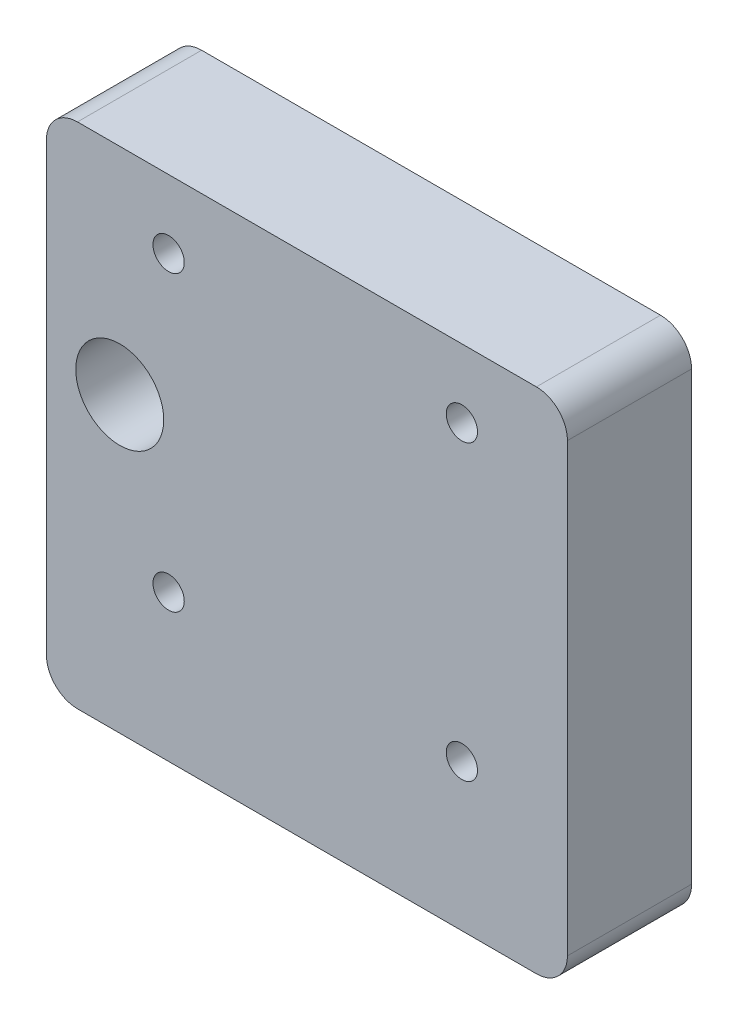
from build123d import *
from build123d.topology import SkipClean

# Parameters (mm, degrees)
SKETCH1_R           = 1.6
BOSS_EXTRUDE1_DEPTH = 12.7
SKETCH2_W           = 48.3
SKETCH2_H           = 8
BOSS_EXTRUDE2_DEPTH = 12.7
CUT_EXTRUDE3_DEPTH  = 73.098404975
FILLET1_R           = 3.175


with BuildPart() as part:
    # Sketch1 → Boss-Extrude1 (new body)
    with BuildSketch(Plane.XY):
        with BuildLine():
            Line((48.3, 0), (0, 0))
            Line((0, 0), (0, -18.258342613))
            ThreePointArc((0, -18.258342613), (4.621320344, -18.031373033), (7, -22))
            ThreePointArc((7, -22), (4.621320344, -25.968626967), (0, -25.741657387))
            Line((0, -25.741657387), (0, -44))
            Line((0, -44), (48.3, -44))
            Line((48.3, -44), (48.3, 0))
        make_face()
        with Locations((7.5, -37)):
            Circle(SKETCH1_R, mode=Mode.SUBTRACT)
        with Locations((37.5, -37)):
            Circle(SKETCH1_R, mode=Mode.SUBTRACT)
        with Locations((7.5, -7)):
            Circle(SKETCH1_R, mode=Mode.SUBTRACT)
        with Locations((37.5, -7)):
            Circle(SKETCH1_R, mode=Mode.SUBTRACT)
    extrude(amount=BOSS_EXTRUDE1_DEPTH)

    # Sketch2 → Boss-Extrude2 (add)
    with BuildSketch(Plane.XY.offset(12.7)):
        Polygon((0, -52), (0, -44), (0, -25.741657387), (0, -18.258342613), (0, 0), (-5, 0), (-5, -52), align=None)
        with Locations((24.15, -48)):
            Rectangle(SKETCH2_W, SKETCH2_H)
    extrude(amount=-BOSS_EXTRUDE2_DEPTH)

    # Sketch1<5> → Cut-Extrude3 (cut, through all)
    with SkipClean():  # the faces are left unmerged after this step: merging them gives an invalid solid
        with BuildSketch(Plane.XY):
            with BuildLine():
                ThreePointArc((7, -22), (4.621320344, -18.031373033), (0, -18.258342613))
                Line((0, -18.258342613), (0, -25.741657387))
                ThreePointArc((0, -25.741657387), (4.621320344, -25.968626967), (7, -22))
            make_face()
            with BuildLine():
                Line((0, -25.741657387), (0, -18.258342613))
                ThreePointArc((0, -18.258342613), (-2, -22), (0, -25.741657387))
            make_face()
        extrude(amount=CUT_EXTRUDE3_DEPTH, mode=Mode.SUBTRACT)

    # Fillet1
    fillet1_edges = [part.edges().sort_by_distance(p)[0] for p in [
        (48.3, 0, 6.35),
        (-5, 0, 6.35),
        (48.3, -52, 6.35),
        (-5, -52, 6.35),
    ]]
    fillet(fillet1_edges, radius=FILLET1_R)


solid = part.part
